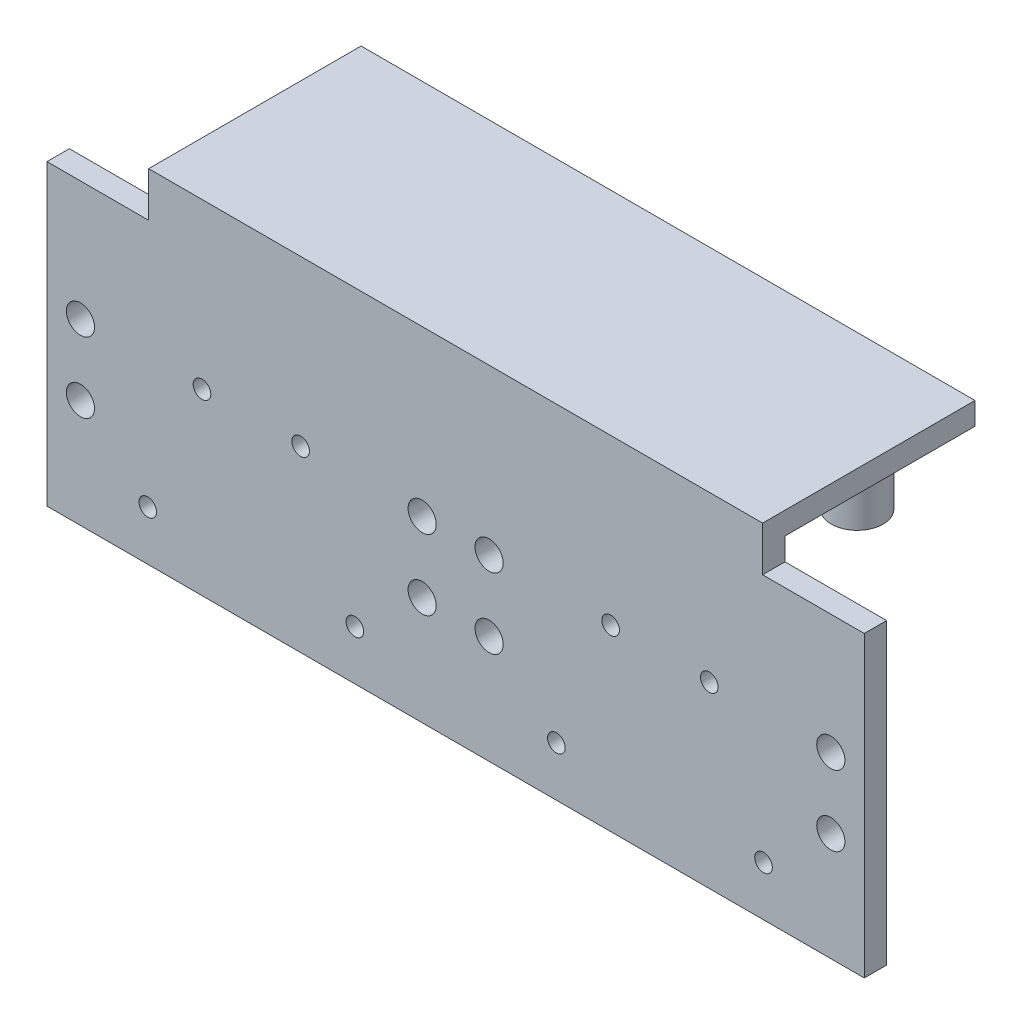
from build123d import *

# Parameters (mm, degrees)
SKETCH1_W           = 116
SKETCH1_H           = 34.5
BOSS_EXTRUDE1_DEPTH = 3.175
SKETCH2_R           = 2
SKETCH2_R_2         = 1.25
CUT_EXTRUDE1_DEPTH  = 95.79098388
SKETCH3_W           = 116
SKETCH3_H           = 3.175
BOSS_EXTRUDE2_DEPTH = 14.1986
SKETCH4_W           = 116
SKETCH4_H           = 3.175
BOSS_EXTRUDE3_DEPTH = 26.9748
SKETCH6_R           = 3.678354521
SKETCH6_R_2         = 3.671158805
BOSS_EXTRUDE4_DEPTH = 6.35
SKETCH7_W           = 14.431210835
SKETCH7_H           = 30.1498
CUT_EXTRUDE2_DEPTH  = 6.35


with BuildPart() as part:
    # Sketch1 → Boss-Extrude1 (new body)
    with BuildSketch(Plane.XY):
        with Locations((-29, -20.25)):
            Rectangle(SKETCH1_W, SKETCH1_H)
    extrude(amount=BOSS_EXTRUDE1_DEPTH)

    # Sketch2 → Cut-Extrude1 (cut, through all)
    with BuildSketch(Plane(origin=(0, 0, 0), x_dir=(-1, 0, 0), z_dir=(0, 0, -1))):
        with Locations((-24.25, -22.13)):
            Circle(SKETCH2_R)
        with Locations((-24.25, -12.13)):
            Circle(SKETCH2_R)
        with Locations((24.25, -12.13)):
            Circle(SKETCH2_R)
        with Locations((24.25, -22.13)):
            Circle(SKETCH2_R)
        with Locations((33.75, -12.13)):
            Circle(SKETCH2_R)
        with Locations((33.75, -22.13)):
            Circle(SKETCH2_R)
        with Locations((82.25, -12.13)):
            Circle(SKETCH2_R)
        with Locations((82.25, -22.13)):
            Circle(SKETCH2_R)
        with Locations((72.699747468, -30.449747468)):
            Circle(SKETCH2_R_2)
        with Locations((65, -12.13)):
            Circle(SKETCH2_R_2)
        with Locations((51, -12.13)):
            Circle(SKETCH2_R_2)
        with Locations((43.300252532, -30.449747468)):
            Circle(SKETCH2_R_2)
        with Locations((14.699747468, -30.449747468)):
            Circle(SKETCH2_R_2)
        with Locations((7, -12.13)):
            Circle(SKETCH2_R_2)
        with Locations((-7, -12.13)):
            Circle(SKETCH2_R_2)
        with Locations((-14.699747468, -30.449747468)):
            Circle(SKETCH2_R_2)
    extrude(amount=-CUT_EXTRUDE1_DEPTH, mode=Mode.SUBTRACT)

    # Sketch3 → Boss-Extrude2 (add)
    with BuildSketch(Plane(origin=(0, -3, 0), x_dir=(1, 0, 0), z_dir=(0, 1, 0))):
        with Locations((-29, -1.5875)):
            Rectangle(SKETCH3_W, SKETCH3_H)
    extrude(amount=BOSS_EXTRUDE2_DEPTH)

    # Sketch4 → Boss-Extrude3 (add)
    with BuildSketch(Plane(origin=(0, 0, 0), x_dir=(-1, 0, 0), z_dir=(0, 0, -1))):
        with Locations((29, 9.6111)):
            Rectangle(SKETCH4_W, SKETCH4_H)
    extrude(amount=BOSS_EXTRUDE3_DEPTH)

    # Sketch6 → Boss-Extrude4 (add)
    with BuildSketch(Plane.XZ.offset(-8.0236)):
        with Locations(Location((10.05, -14.77, 0), (0, 0, 90))):
            Circle(SKETCH6_R)
        with Locations(Location((-68.05, -14.97, 0), (0, 0, 90))):
            Circle(SKETCH6_R_2)
    extrude(amount=BOSS_EXTRUDE4_DEPTH)

    # Sketch7 → Cut-Extrude2 (cut)
    with BuildSketch(Plane(origin=(0, 11.1986, 0), x_dir=(1, 0, 0), z_dir=(0, 1, 0))):
        with Locations((-79.784394582, 11.8999)):
            Rectangle(SKETCH7_W, SKETCH7_H)
        with Locations((21.784394583, 11.8999)):
            Rectangle(SKETCH7_W, SKETCH7_H)
    extrude(amount=-CUT_EXTRUDE2_DEPTH, mode=Mode.SUBTRACT)


solid = part.part
